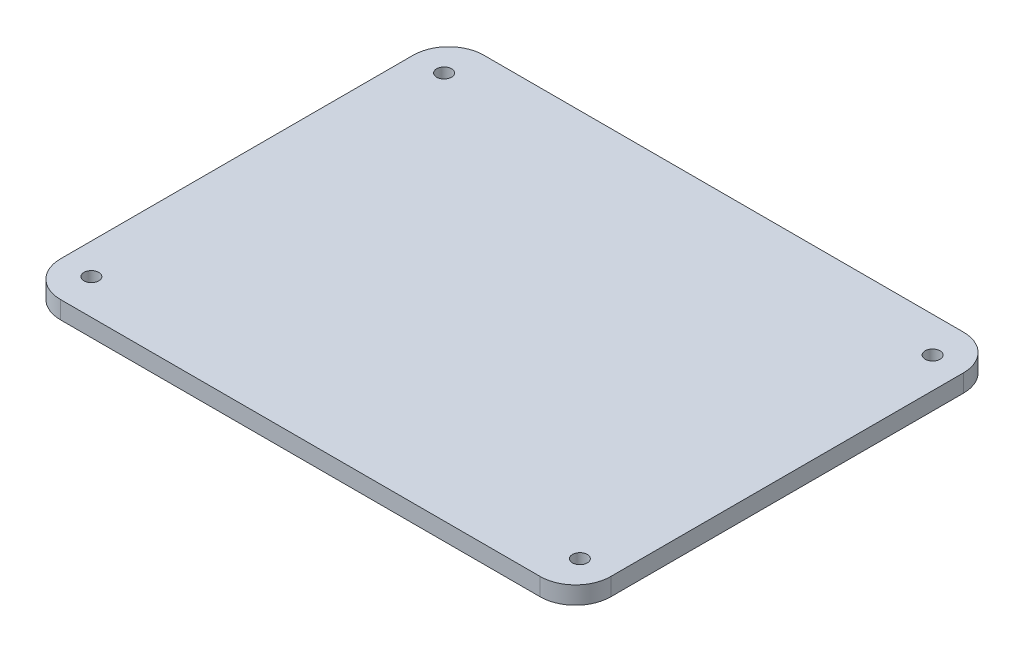
from build123d import *

# Parameters (mm, degrees)
SKETCH5_W           = 156
SKETCH5_H           = 120
BOSS_EXTRUDE3_DEPTH = 5
SKETCH6_R           = 2.1
CUT_EXTRUDE2_DEPTH  = 99.534258002
FILLET1_R           = 10


with BuildPart() as part:
    # Sketch5 → Boss-Extrude3 (new body)
    with BuildSketch(Plane(origin=(0, 0, 0), x_dir=(1, 0, 0), z_dir=(0, 1, 0))):
        Rectangle(SKETCH5_W, SKETCH5_H)
    extrude(amount=BOSS_EXTRUDE3_DEPTH)

    # Sketch6 → Cut-Extrude2 (cut, through all)
    with BuildSketch(Plane(origin=(0, 5, 0), x_dir=(1, 0, 0), z_dir=(0, 1, 0))):
        with Locations(Location((-69.25, 50, 0), (0, 0, 270))):
            Circle(SKETCH6_R)
        with Locations(Location((69.25, 50, 0), (0, 0, 270))):
            Circle(SKETCH6_R)
        with Locations(Location((-69.25, -50, 0), (0, 0, 270))):
            Circle(SKETCH6_R)
        with Locations(Location((69.25, -50, 0), (0, 0, 270))):
            Circle(SKETCH6_R)
    extrude(amount=-CUT_EXTRUDE2_DEPTH, mode=Mode.SUBTRACT)

    # Fillet1
    fillet1_edges = [part.edges().sort_by_distance(p)[0] for p in [
        (78, 2.5, 60),
        (-78, 2.5, 60),
        (-78, 2.5, -60),
        (78, 2.5, -60),
    ]]
    fillet(fillet1_edges, radius=FILLET1_R)


solid = part.part
